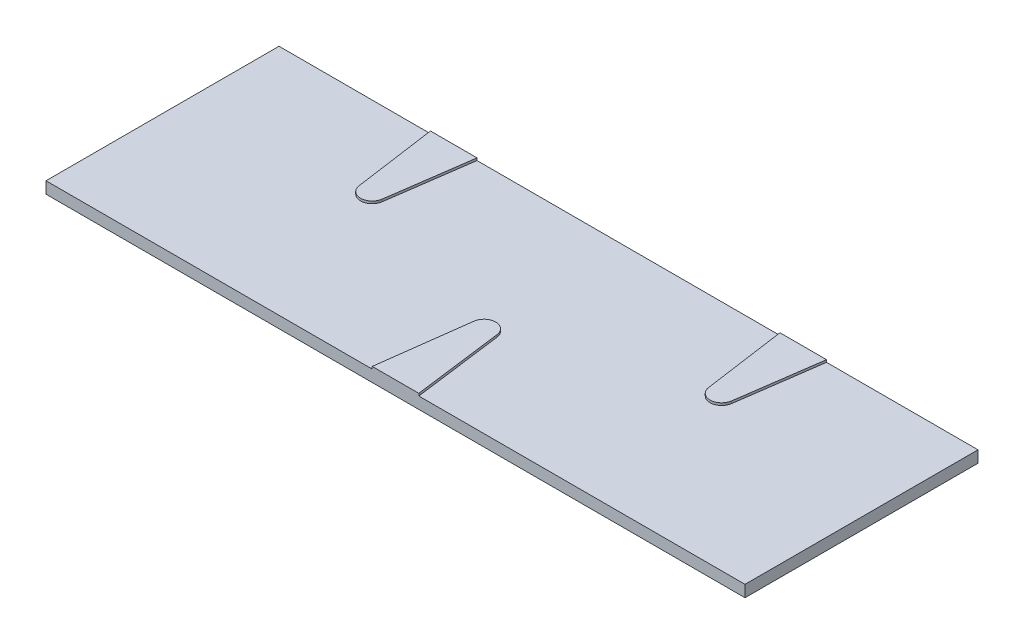
from build123d import *

# Parameters (mm, degrees)
SKETCH1_W           = 300
SKETCH1_H           = 100
BOSS_EXTRUDE1_DEPTH = 5
BOSS_EXTRUDE2_DEPTH = 1


with BuildPart() as part:
    # Sketch1 → Boss-Extrude1 (new body)
    with BuildSketch(Plane(origin=(0, 0, 0), x_dir=(1, 0, 0), z_dir=(0, 1, 0))):
        Rectangle(SKETCH1_W, SKETCH1_H)
    extrude(amount=BOSS_EXTRUDE1_DEPTH)

    # Sketch2 → Boss-Extrude2 (add)
    with BuildSketch(Plane(origin=(0, 5, 0), x_dir=(1, 0, 0), z_dir=(0, 1, 0))):
        with BuildLine():
            Line((-85, 50), (-79.9507281, 14.299791972))
            ThreePointArc((-79.9507281, 14.299791972), (-75, 10), (-70.0492719, 14.299791972))
            Line((-70.0492719, 14.299791972), (-65, 50))
            Line((-65, 50), (-85, 50))
        make_face()
        with BuildLine():
            Line((70.0492719, 14.299791972), (65, 50))
            Line((65, 50), (85, 50))
            Line((85, 50), (79.9507281, 14.299791972))
            ThreePointArc((79.9507281, 14.299791972), (75, 10), (70.0492719, 14.299791972))
        make_face()
        with BuildLine():
            Line((4.957983551, -11.353162223), (10, -50))
            Line((10, -50), (-10, -50))
            Line((-10, -50), (-4.957983551, -11.353162223))
            ThreePointArc((-4.957983551, -11.353162223), (0, -7), (4.957983551, -11.353162223))
        make_face()
    extrude(amount=BOSS_EXTRUDE2_DEPTH)


solid = part.part
